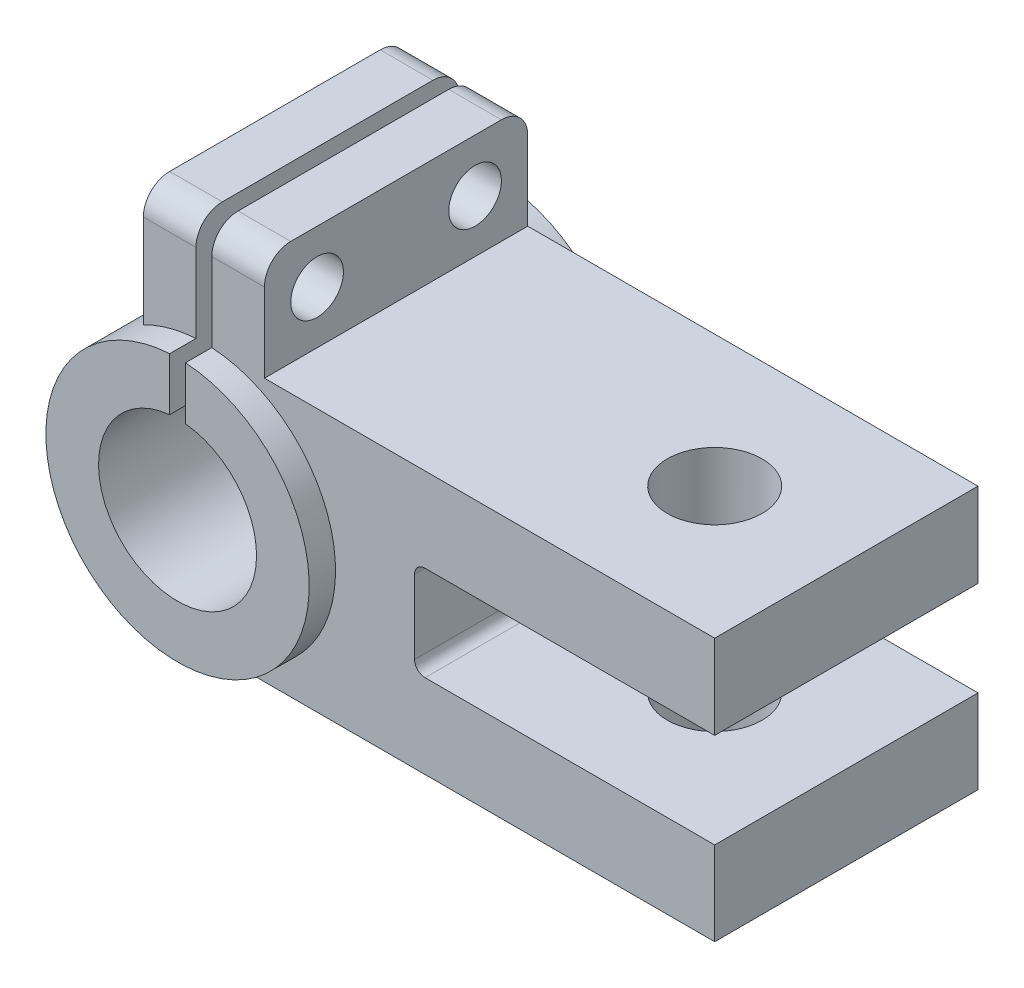
from build123d import *

# Parameters (mm, degrees)
ESTRUSIONE_ESTRUSIONE3_DEPTH = 30
ESTRUSIONE_ESTRUSIONE4_DEPTH = 25
FORO_18_0_18_1_D             = 18
FORO_10_0_10_1_D             = 10
RACCORDO1_R                  = 5
RACCORDO2_R                  = 2


with BuildPart() as part:
    # Schizzo1 → Estrusione-Estrusione3 (new, symmetric)
    with BuildSketch(Plane.XY):
        with BuildLine():
            ThreePointArc((-1.5, 24.954959427), (-6.644564975, 24.100824805), (-11.5, 22.19797288))
            ThreePointArc((-11.5, 22.19797288), (-24.289394002, -5.918220932), (0, -25))
            ThreePointArc((0, -25), (17.67766953, -17.67766953), (25, 0))
            ThreePointArc((25, 0), (21.360009363, 12.990381057), (11.5, 22.19797288))
            ThreePointArc((11.5, 22.19797288), (6.644564975, 24.100824805), (1.5, 24.954959427))
            Line((1.5, 24.954959427), (1.5, 14.924811557))
            ThreePointArc((1.5, 14.924811557), (11.124297731, 10.062305899), (15, 0))
            ThreePointArc((15, 0), (-10.062305899, -11.124297731), (-1.5, 14.924811557))
            Line((-1.5, 14.924811557), (-1.5, 24.954959427))
        make_face()
    extrude(amount=ESTRUSIONE_ESTRUSIONE3_DEPTH, both=True)

    # Schizzo1<3> → Estrusione-Estrusione4 (add, symmetric)
    with BuildSketch(Plane.XY):
        with BuildLine():
            Line((-11.5, 44.924811557), (-11.5, 22.19797288))
            ThreePointArc((-11.5, 22.19797288), (-6.644564975, 24.100824805), (-1.5, 24.954959427))
            Line((-1.5, 24.954959427), (-1.5, 44.924811557))
            Line((-1.5, 44.924811557), (-11.5, 44.924811557))
        make_face()
        with BuildLine():
            Line((0, -25), (97, -25))
            Line((97, -25), (97, -9.075188443))
            Line((97, -9.075188443), (40, -9.075188443))
            Line((40, -9.075188443), (40, 8.924811557))
            Line((40, 8.924811557), (97, 8.924811557))
            Line((97, 8.924811557), (97, 24.924811557))
            Line((97, 24.924811557), (11.5, 24.924811557))
            Line((11.5, 24.924811557), (11.5, 44.924811557))
            Line((11.5, 44.924811557), (1.5, 44.924811557))
            Line((1.5, 44.924811557), (1.5, 24.954959427))
            ThreePointArc((1.5, 24.954959427), (24.98873732, -0.750338033), (0, -25))
        make_face()
    extrude(amount=ESTRUSIONE_ESTRUSIONE4_DEPTH, both=True)

    # Foro Ø18.0 (18)-1 (through all)
    with Locations(Plane(origin=(0, -25, 0), x_dir=(-1, 0, 0), z_dir=(0, -1, 0))):
        with Locations((-72, 0)):
            Hole(FORO_18_0_18_1_D / 2)

    # Foro Ø10.0 (10)-1 (through all)
    with Locations(Plane.ZY.offset(11.5)):
        with Locations((15, 34.924811557), (-15, 34.924811557)):
            Hole(FORO_10_0_10_1_D / 2)

    # Raccordo1
    raccordo1_edges = [part.edges().sort_by_distance(p)[0] for p in [
        (-6.5, 44.924811557, 25),
        (6.5, 44.924811557, 25),
        (-6.5, 44.924811557, -25),
        (6.5, 44.924811557, -25),
    ]]
    fillet(raccordo1_edges, radius=RACCORDO1_R)

    # Raccordo2
    raccordo2_edges = [part.edges().sort_by_distance(p)[0] for p in [
        (40, -9.075188443, 0),
        (40, 8.924811557, 0),
    ]]
    fillet(raccordo2_edges, radius=RACCORDO2_R)


solid = part.part
